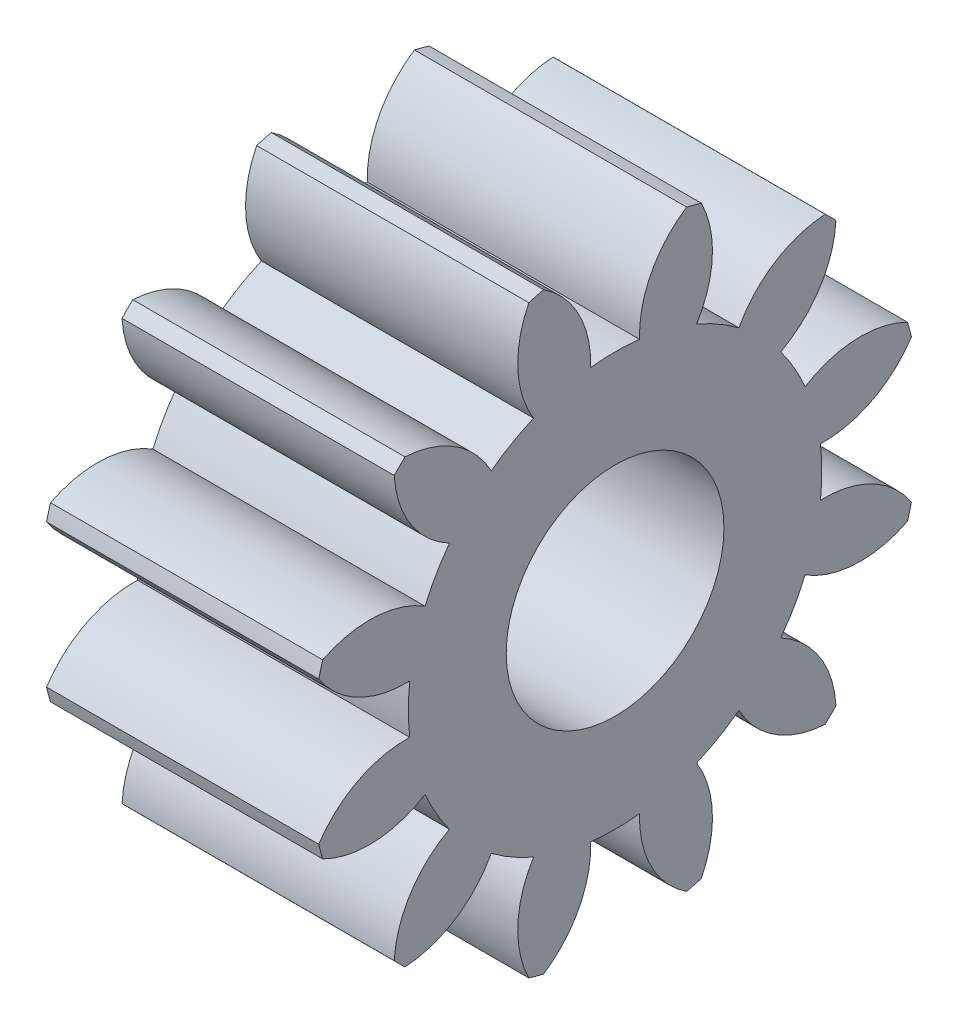
from build123d import *

# Parameters (mm, degrees)
BASPROSKE_W     = 5
BASPROSKE_H     = 5.6
TOOTHCUT_DEPTH  = 10.365895579
TEETHCUTS_COUNT = 12
TEETHCUTS_ANGLE = 330
BORSKE_R        = 2
BORE_DEPTH      = 50.0000508


with BuildPart() as part:
    # BasProSke → Base-Revolve (revolve)
    with BuildSketch(Plane(origin=(0, 0, 0), x_dir=(1, 0, 0), z_dir=(0, 1, 0)), mode=Mode.PRIVATE) as base_revolve_sk:
        with Locations((2.5, 2.8)):
            Rectangle(BASPROSKE_W, BASPROSKE_H)
    revolve(base_revolve_sk.sketch.rotate(Axis((-10, 0, 0), (1, 0, 0)), 180), axis=Axis((-10, 0, 0), (1, 0, 0)))

    # TooCutSke → ToothCut (cut, through all)
    with BuildSketch(Plane(origin=(0, 0, 0), x_dir=(0, 0, -1), z_dir=(1, 0, 0))):
        with BuildLine():
            ThreePointArc((0.449218713, 3.77234722), (0, 3.799), (-0.449218713, 3.77234722))
            ThreePointArc((-0.449218713, 3.77234722), (-0.670924606, 4.73673149), (-1.343429094, 5.462629717))
            ThreePointArc((-1.343429094, 5.462629717), (0, 5.6254), (1.343429094, 5.462629717))
            ThreePointArc((1.343429094, 5.462629717), (0.670924606, 4.73673149), (0.449218713, 3.77234722))
        make_face()
    toothcut = extrude(amount=TOOTHCUT_DEPTH, mode=Mode.SUBTRACT)

    # TeethCuts: ToothCut ×12 about axis
    teethcuts_axis = Axis((-10, 0, 0), (1, 0, 0))
    for i in range(1, TEETHCUTS_COUNT):
        add(toothcut.rotate(teethcuts_axis, i * TEETHCUTS_ANGLE / (TEETHCUTS_COUNT - 1)), mode=Mode.SUBTRACT)

    # BorSke → Bore (cut, symmetric)
    with BuildSketch(Plane(origin=(0, 0, 0), x_dir=(0, 0, -1), z_dir=(1, 0, 0))):
        with Locations(Location((0, 0, 0), (0, 0, 180))):
            Circle(BORSKE_R)
    extrude(amount=BORE_DEPTH, both=True, mode=Mode.SUBTRACT)


solid = part.part
